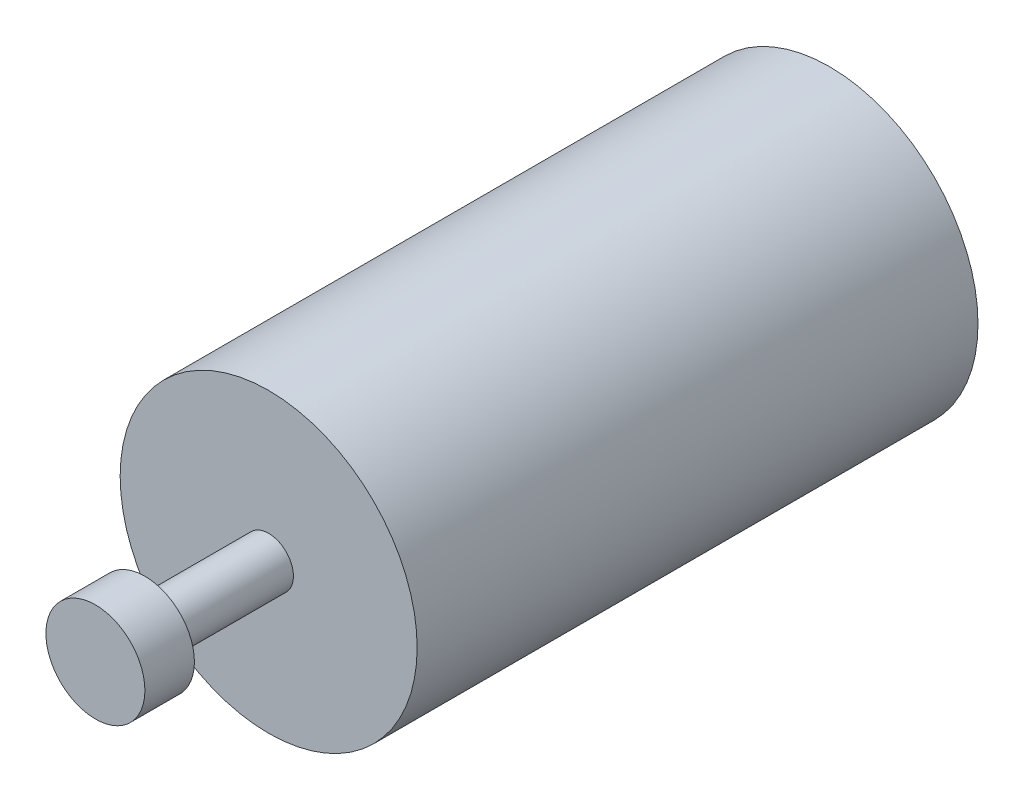
from build123d import *

# Parameters (mm, degrees)
SKETCH1_R           = 3.175
BOSS_EXTRUDE1_DEPTH = 14.478
SKETCH2_R           = 38.1
BOSS_EXTRUDE2_DEPTH = 143.891
SKETCH3_W           = 2.54
SKETCH3_H           = 5.08
BOSS_EXTRUDE3_DEPTH = 14.478
SKETCH4_R           = 5.999533244
BOSS_EXTRUDE4_DEPTH = 5.08
SKETCH5_R           = 6.35
BOSS_EXTRUDE5_DEPTH = 31.75
SKETCH6_R           = 12.7
BOSS_EXTRUDE6_DEPTH = 12.7


with BuildPart() as part:
    # Sketch1 → Boss-Extrude1 (new body)
    with BuildSketch(Plane.XY):
        Circle(SKETCH1_R)
    extrude(amount=BOSS_EXTRUDE1_DEPTH)

    # Sketch2 → Boss-Extrude2 (add)
    with BuildSketch(Plane.XY.offset(14.478)):
        Circle(SKETCH2_R)
    extrude(amount=BOSS_EXTRUDE2_DEPTH)

    # Sketch3 → Boss-Extrude3 (add)
    with BuildSketch(Plane(origin=(0, 0, 0), x_dir=(-1, 0, 0), z_dir=(0, 0, -1))):
        with Locations((0, 3.175)):
            Rectangle(SKETCH3_W, SKETCH3_H)
    extrude(amount=-BOSS_EXTRUDE3_DEPTH)

    # Sketch4 → Boss-Extrude4 (add)
    with BuildSketch(Plane(origin=(0, 0, 0), x_dir=(-1, 0, 0), z_dir=(0, 0, -1))):
        Circle(SKETCH4_R)
    extrude(amount=BOSS_EXTRUDE4_DEPTH)

    # Sketch5 → Boss-Extrude5 (add)
    with BuildSketch(Plane.XY.offset(158.369)):
        Circle(SKETCH5_R)
    extrude(amount=BOSS_EXTRUDE5_DEPTH)

    # Sketch6 → Boss-Extrude6 (add)
    with BuildSketch(Plane.XY.offset(190.119)):
        Circle(SKETCH6_R)
    extrude(amount=BOSS_EXTRUDE6_DEPTH)


solid = part.part
